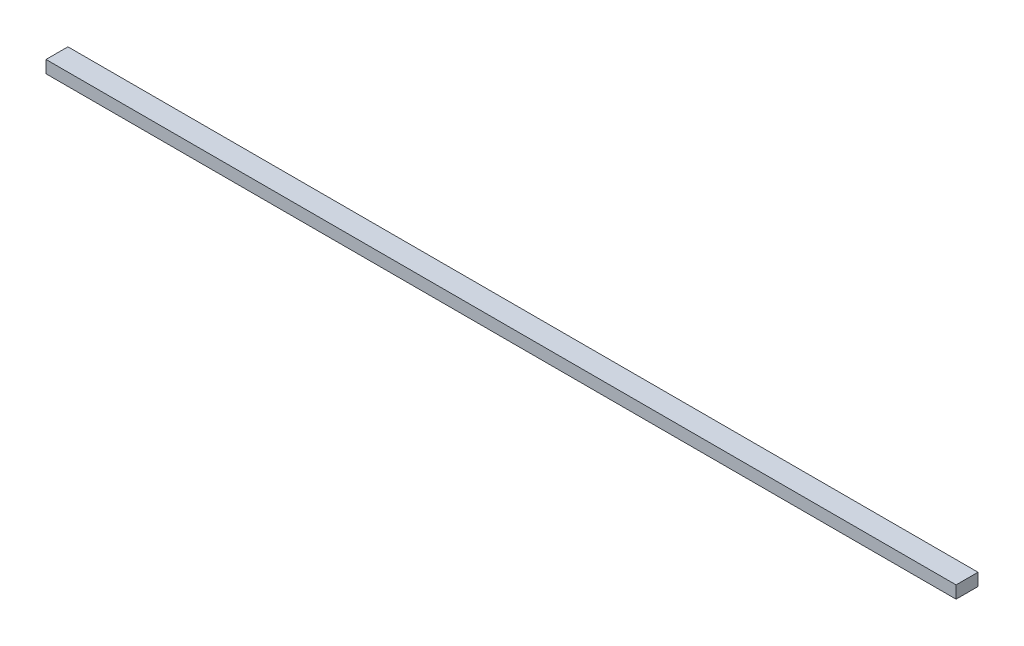
from build123d import *

# Parameters (mm, degrees)
SKETCH1_W           = 220
SKETCH1_H           = 5.3
BOSS_EXTRUDE1_DEPTH = 3


with BuildPart() as part:
    # Sketch1 → Boss-Extrude1 (new body)
    with BuildSketch(Plane(origin=(0, 0, 0), x_dir=(1, 0, 0), z_dir=(0, 1, 0))):
        Rectangle(SKETCH1_W, SKETCH1_H)
    extrude(amount=BOSS_EXTRUDE1_DEPTH)


solid = part.part
